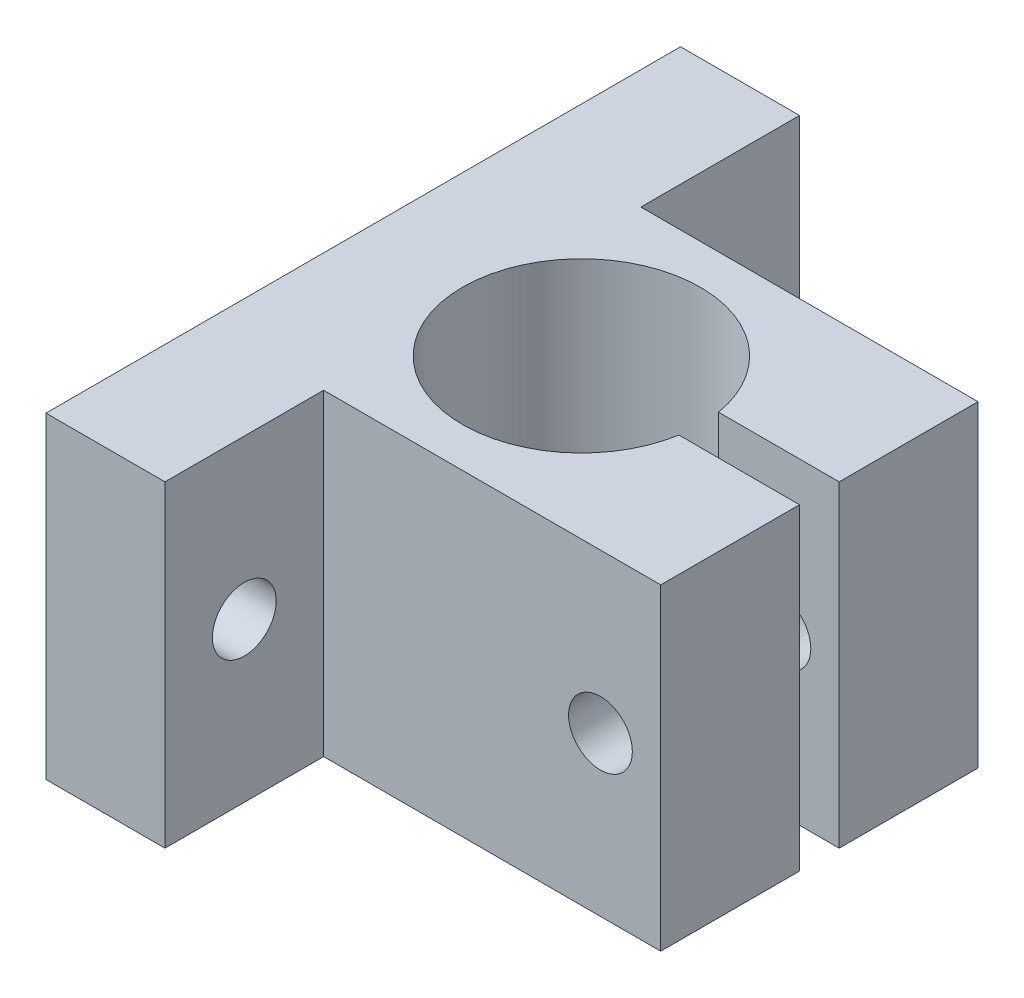
from build123d import *

# Parameters (mm, degrees)
SKETCH1_W                   = 50.8
SKETCH1_H                   = 50.8
STOCK_BLOCK_DEPTH           = 12.7
SKETCH2_R                   = 9.525
SLEEVE_NUT_HOLE_LARGE_DEPTH = 44.994090512
SKETCH11_W                  = 14.2875
SKETCH11_H                  = 50.8
CUT_EXTRUDE4_DEPTH          = 44.994090512
SKETCH3_W                   = 26.9875
SKETCH3_H                   = 12.7
CUT_EXTRUDE2_DEPTH          = 44.994090512
F_10_CLEARANCE_HOLE1_D      = 5.1054
SKETCH6_W                   = 3.175
SKETCH6_H                   = 37.090012852
CUT_EXTRUDE3_DEPTH          = 24.13
F_10_CLEARANCE_HOLE2_D      = 5.1054


with BuildPart() as part:
    # Sketch1 → Stock block (new, symmetric)
    with BuildSketch(Plane(origin=(0, 0, 0), x_dir=(1, 0, 0), z_dir=(0, 1, 0))):
        Rectangle(SKETCH1_W, SKETCH1_H)
    extrude(amount=STOCK_BLOCK_DEPTH, both=True)

    # Sketch2 → Sleeve Nut Hole - Large (cut, through all)
    with BuildSketch(Plane(origin=(0, 12.7, 0), x_dir=(1, 0, 0), z_dir=(0, 1, 0))):
        with Locations(Location((-7.9375, 0, 0), (0, 0, 270))):
            Circle(SKETCH2_R)
    extrude(amount=-SLEEVE_NUT_HOLE_LARGE_DEPTH, mode=Mode.SUBTRACT)

    # Sketch11 → Cut-Extrude4 (cut, through all)
    with BuildSketch(Plane(origin=(0, 12.7, 0), x_dir=(1, 0, 0), z_dir=(0, 1, 0))):
        with Locations((18.25625, 0)):
            Rectangle(SKETCH11_W, SKETCH11_H)
    extrude(amount=-CUT_EXTRUDE4_DEPTH, mode=Mode.SUBTRACT)

    # Sketch3 → Cut-Extrude2 (cut, through all)
    with BuildSketch(Plane(origin=(0, 12.7, 0), x_dir=(1, 0, 0), z_dir=(0, 1, 0))):
        with Locations((-2.38125, 19.05)):
            Rectangle(SKETCH3_W, SKETCH3_H)
        with Locations((-2.38125, -19.05)):
            Rectangle(SKETCH3_W, SKETCH3_H)
    extrude(amount=-CUT_EXTRUDE2_DEPTH, mode=Mode.SUBTRACT)

    # #10 Clearance Hole1 (through all)
    with Locations(Plane(origin=(-15.875, 0, 0), x_dir=(0, 0, -1), z_dir=(1, 0, 0))):
        with Locations((-19.05, 0), (19.05, 0)):
            Hole(F_10_CLEARANCE_HOLE1_D / 2)

    # Sketch6 → Cut-Extrude3 (cut)
    with BuildSketch(Plane(origin=(11.1125, 0, 0), x_dir=(0, 0, -1), z_dir=(1, 0, 0))):
        Rectangle(SKETCH6_W, SKETCH6_H)
    extrude(amount=-CUT_EXTRUDE3_DEPTH, mode=Mode.SUBTRACT)

    # #10 Clearance Hole2 (through all)
    with Locations(Plane.XY.offset(12.7)):
        with Locations((6.2865, 0)):
            Hole(F_10_CLEARANCE_HOLE2_D / 2)


solid = part.part
